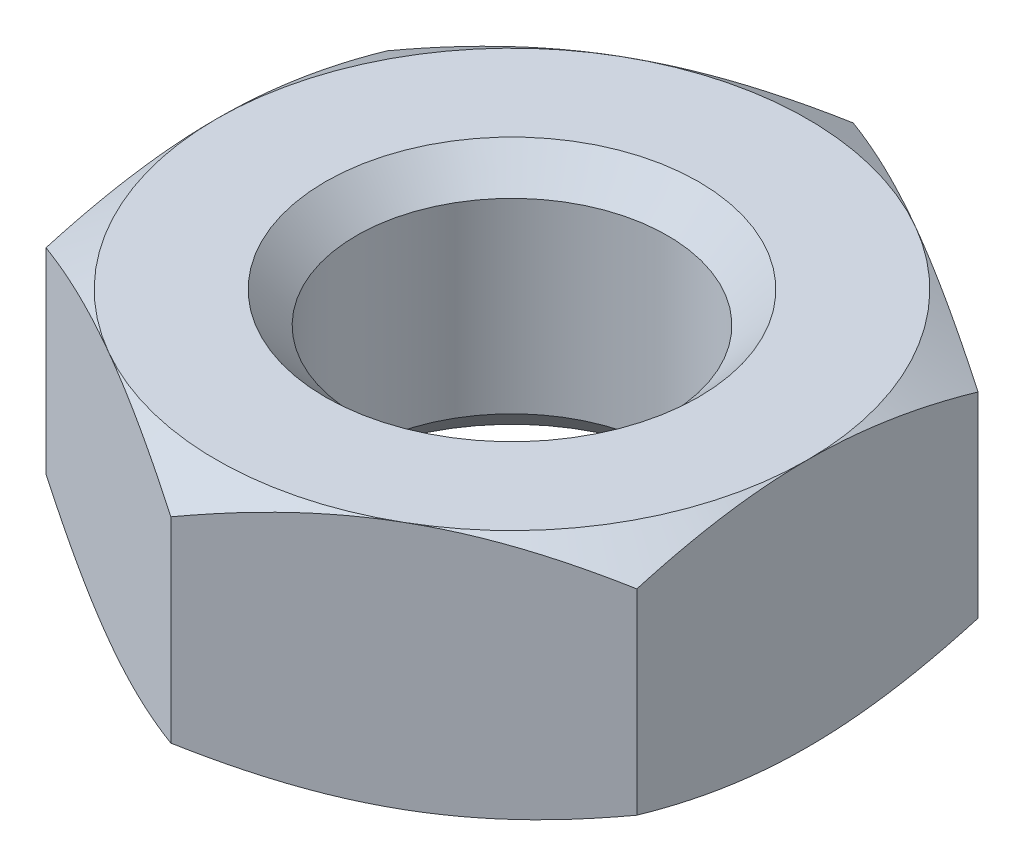
from build123d import *

# Parameters (mm, degrees)
SKETCH1_R           = 5
BOSS_EXTRUDE1_DEPTH = 8
CHAMFER1_SIZE       = 1
SKETCH2_OUTSIDE_W   = 54.734
SKETCH2_OUTSIDE_H   = 57.674
SKETCH2_OUTSIDE_R   = 9.5
CUT_EXTRUDE1_DEPTH  = 8
CUT_EXTRUDE1_DRAFT  = -60
SKETCH3_OUTSIDE_W   = 54.734
SKETCH3_OUTSIDE_H   = 57.674
SKETCH3_OUTSIDE_R   = 9.5
CUT_EXTRUDE2_DEPTH  = 8
CUT_EXTRUDE2_DRAFT  = -60


with BuildPart() as part:
    # Sketch1 → Boss-Extrude1 (new body)
    with BuildSketch(Plane(origin=(0, 0, 0), x_dir=(1, 0, 0), z_dir=(0, 1, 0))):
        Polygon((9.5, -5.484827557), (9.5, 5.484827557), (0, 10.969655115), (-9.5, 5.484827557), (-9.5, -5.484827557), (0, -10.969655115), align=None)
        with Locations(Location((0, 0, 0), (0, 0, 270))):
            Circle(SKETCH1_R, mode=Mode.SUBTRACT)
    extrude(amount=BOSS_EXTRUDE1_DEPTH)

    # Chamfer1
    chamfer1_edges = [part.edges().sort_by_distance(p)[0] for p in [
        (0, 0, -5),
        (0, 8, -5),
    ]]
    chamfer(chamfer1_edges, length=CHAMFER1_SIZE)


with BuildPart() as cut_extrude1_tool:
    # Sketch2 outside → Cut-Extrude1 (with draft: the straight prism first)
    with BuildSketch(Plane(origin=(0, 8, 0), x_dir=(1, 0, 0), z_dir=(0, 1, 0))):
        Rectangle(SKETCH2_OUTSIDE_W, SKETCH2_OUTSIDE_H)
        Circle(SKETCH2_OUTSIDE_R, mode=Mode.SUBTRACT)
    extrude(amount=-CUT_EXTRUDE1_DEPTH)
    # Cut-Extrude1: the draft: its side faces are tilted about the plane it starts from
    cut_extrude1_sides = [cut_extrude1_tool.faces().sort_by_distance(p)[0] for p in [
        (0, 4, 28.837),
        (27.367, 4, 0),
        (0, 4, -28.837),
        (-27.367, 4, 0),
        (-9.5, 4, 0),
    ]]
    draft(cut_extrude1_sides, Plane(origin=(0, 8, 0), x_dir=(1, 0, 0), z_dir=(0, 1, 0)), CUT_EXTRUDE1_DRAFT)


with BuildPart() as part_1:
    add(part.part)

    # Cut-Extrude1: cut by cut_extrude1_tool
    add(cut_extrude1_tool.part, mode=Mode.SUBTRACT)


with BuildPart() as cut_extrude2_tool:
    # Sketch3 outside → Cut-Extrude2 (with draft: the straight prism first)
    with BuildSketch(Plane.XZ):
        Rectangle(SKETCH3_OUTSIDE_W, SKETCH3_OUTSIDE_H)
        Circle(SKETCH3_OUTSIDE_R, mode=Mode.SUBTRACT)
    extrude(amount=-CUT_EXTRUDE2_DEPTH)
    # Cut-Extrude2: the draft: its side faces are tilted about the plane it starts from
    cut_extrude2_sides = [cut_extrude2_tool.faces().sort_by_distance(p)[0] for p in [
        (0, 4, -28.837),
        (27.367, 4, 0),
        (0, 4, 28.837),
        (-27.367, 4, 0),
        (-9.5, 4, 0),
    ]]
    draft(cut_extrude2_sides, Plane.XZ, CUT_EXTRUDE2_DRAFT)


with BuildPart() as part_2:
    add(part_1.part)

    # Cut-Extrude2: cut by cut_extrude2_tool
    add(cut_extrude2_tool.part, mode=Mode.SUBTRACT)


solid = part_2.part
